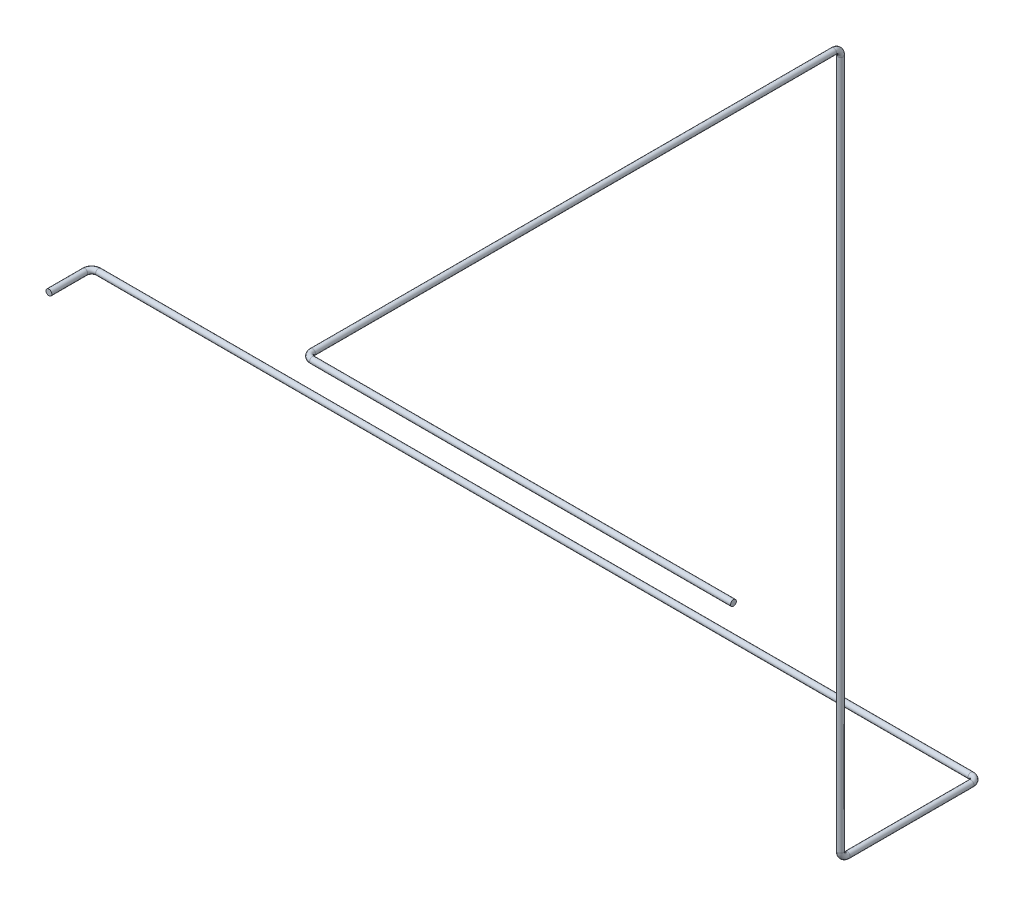
from build123d import *

# Parameters (mm, degrees)
CROQUIS1_R              = 19.05
SALIENTE_EXTRUIR1_DEPTH = 200
CROQUIS2_R              = 19.05


with BuildPart() as part:
    # Croquis1 → Saliente-Extruir1 (new body)
    with BuildSketch(Plane.XY):
        Circle(CROQUIS1_R)
    extrude(amount=SALIENTE_EXTRUIR1_DEPTH)

    # Barrer1: sweep along a curve in space
    with BuildLine() as barrer1_path:
        Line((0, 0, 0), (0, 0, -35))
        ThreePointArc((0, 0, -35), (13.180194847, 0, -66.819805153), (45, 0, -80))
        Line((45, 0, -80), (5755, 0, -80))
        ThreePointArc((5755, 0, -80), (5786.819805153, 0, -66.819805153), (5800, 0, -35))
        Line((5800, 0, -35), (5800, 0, 775))
        ThreePointArc((5800, 0, 775), (5800, 13.180194847, 806.819805153), (5800, 45, 820))
        Line((5800, 45, 820), (5800, 4555, 820))
        ThreePointArc((5800, 4555, 820), (5800, 4586.819805153, 833.180194847), (5800, 4600, 865))
        Line((5800, 4600, 865), (5800, 4600, 4275))
        ThreePointArc((5800, 4600, 4275), (5813.180194847, 4600, 4306.819805153), (5845, 4600, 4320))
        Line((5845, 4600, 4320), (8600, 4600, 4320))
    # Croquis2 → Barrer1 (sweep)
    with BuildSketch(Plane(origin=(0, 0, 0), x_dir=(-1, 0, 0), z_dir=(0, 0, -1))):
        Circle(CROQUIS2_R)
    sweep(path=barrer1_path.line)


solid = part.part
